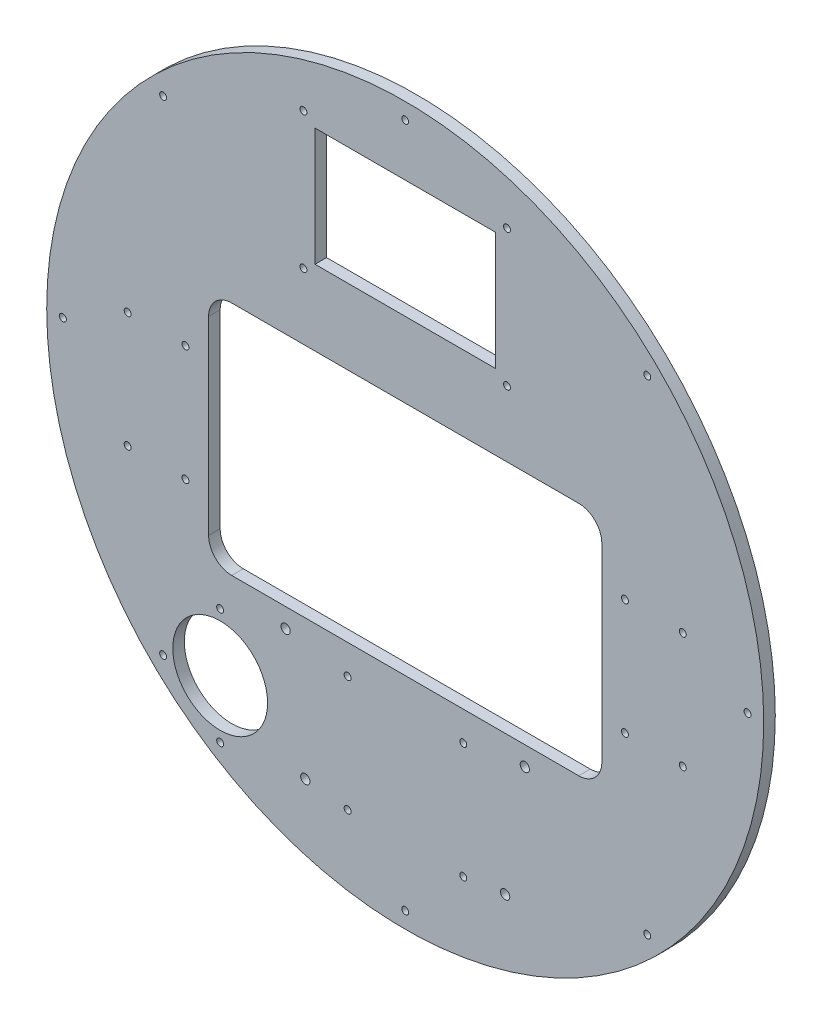
from build123d import *

# Parameters (mm, degrees)
SKETCH_1_R           = 155
EXTRUDE_1_DEPTH      = 5
SKETCH_16_R          = 1.5
CUT_EXTRUDE_15_DEPTH = 220.260119493
SKETCH_17_R          = 1.5
SKETCH_17_R_2        = 20.5
CUT_EXTRUDE_16_DEPTH = 220.260119493
SKETCH_19_R          = 2
SKETCH_19_R_2        = 1.5
CUT_EXTRUDE_17_DEPTH = 220.260119493
CUT_EXTRUDE_18_DEPTH = 220.260119493
SKETCH_21_R          = 1.5
CUT_EXTRUDE_19_DEPTH = 220.260119493
SKETCH_22_R          = 1.5
SKETCH_22_W          = 78
SKETCH_22_H          = 51
CUT_EXTRUDE_20_DEPTH = 220.260119493


with BuildPart() as part:
    # 草图1 → 凸台-拉伸1 (new body)
    with BuildSketch(Plane.XY):
        Circle(SKETCH_1_R)
    extrude(amount=EXTRUDE_1_DEPTH)

    # 草图16 → 切除-拉伸15 (cut, through all)
    with BuildSketch(Plane.XY.offset(5)):
        with Locations((0, 148)):
            Circle(SKETCH_16_R)
        with Locations((104.651803616, 104.651803616)):
            Circle(SKETCH_16_R)
        with Locations((148, 0)):
            Circle(SKETCH_16_R)
        with Locations((104.651803616, -104.651803616)):
            Circle(SKETCH_16_R)
        with Locations((0, -148)):
            Circle(SKETCH_16_R)
        with Locations((-104.651803616, -104.651803616)):
            Circle(SKETCH_16_R)
        with Locations((-148, 0)):
            Circle(SKETCH_16_R)
        with Locations((-104.651803616, 104.651803616)):
            Circle(SKETCH_16_R)
    extrude(amount=-CUT_EXTRUDE_15_DEPTH, mode=Mode.SUBTRACT)

    # 草图17 → 切除-拉伸16 (cut, through all)
    with BuildSketch(Plane.XY.offset(5)):
        with Locations((-80, -75)):
            Circle(SKETCH_17_R)
        with Locations((-80, -125)):
            Circle(SKETCH_17_R)
        with Locations((-80, -100)):
            Circle(SKETCH_17_R_2)
    extrude(amount=-CUT_EXTRUDE_16_DEPTH, mode=Mode.SUBTRACT)

    # 草图19 → 切除-拉伸17 (cut, through all)
    with BuildSketch(Plane.XY.offset(5)):
        with Locations((51.7, -68.3)):
            Circle(SKETCH_19_R)
        with Locations((43.2, -120.3)):
            Circle(SKETCH_19_R)
        with Locations((-43.2, -120.3)):
            Circle(SKETCH_19_R)
        with Locations((-51.7, -68.3)):
            Circle(SKETCH_19_R)
        with Locations((25.1, -72.7)):
            Circle(SKETCH_19_R_2)
        with Locations(Location((25.1, -122.7, 0), (0, 0, 180))):
            Circle(SKETCH_19_R_2)
        with Locations((-24.9, -122.7)):
            Circle(SKETCH_19_R_2)
        with Locations(Location((-24.9, -72.7, 0), (0, 0, 180))):
            Circle(SKETCH_19_R_2)
    extrude(amount=-CUT_EXTRUDE_17_DEPTH, mode=Mode.SUBTRACT)

    # 草图20 → 切除-拉伸18 (cut, through all)
    with BuildSketch(Plane.XY.offset(5)):
        with BuildLine():
            Line((-75, 42), (75, 42))
            ThreePointArc((75, 42), (82.071067812, 39.071067812), (85, 32))
            Line((85, 32), (85, -50))
            ThreePointArc((85, -50), (82.071067812, -57.071067812), (75, -60))
            Line((75, -60), (-75, -60))
            ThreePointArc((-75, -60), (-82.071067812, -57.071067812), (-85, -50))
            Line((-85, -50), (-85, 32))
            ThreePointArc((-85, 32), (-82.071067812, 39.071067812), (-75, 42))
        make_face()
    extrude(amount=-CUT_EXTRUDE_18_DEPTH, mode=Mode.SUBTRACT)

    # 草图21 → 切除-拉伸19 (cut, through all)
    with BuildSketch(Plane.XY.offset(5)):
        with Locations((95, 16)):
            Circle(SKETCH_21_R)
        with Locations((120, 16)):
            Circle(SKETCH_21_R)
        with Locations(Location((120, -34, 0), (0, 0, 180))):
            Circle(SKETCH_21_R)
        with Locations(Location((95, -34, 0), (0, 0, 180))):
            Circle(SKETCH_21_R)
        with Locations((-120, -34)):
            Circle(SKETCH_21_R)
        with Locations((-95, -34)):
            Circle(SKETCH_21_R)
        with Locations(Location((-120, 16, 0), (0, 0, 180))):
            Circle(SKETCH_21_R)
        with Locations(Location((-95, 16, 0), (0, 0, 180))):
            Circle(SKETCH_21_R)
    extrude(amount=-CUT_EXTRUDE_19_DEPTH, mode=Mode.SUBTRACT)

    # 草图22 → 切除-拉伸20 (cut, through all)
    with BuildSketch(Plane.XY.offset(5)):
        with Locations((-44, 129.5)):
            Circle(SKETCH_22_R)
        with Locations((44, 129.5)):
            Circle(SKETCH_22_R)
        with Locations((44, 70.5)):
            Circle(SKETCH_22_R)
        with Locations((-44, 70.5)):
            Circle(SKETCH_22_R)
        with Locations((0, 100)):
            Rectangle(SKETCH_22_W, SKETCH_22_H)
    extrude(amount=-CUT_EXTRUDE_20_DEPTH, mode=Mode.SUBTRACT)


solid = part.part
